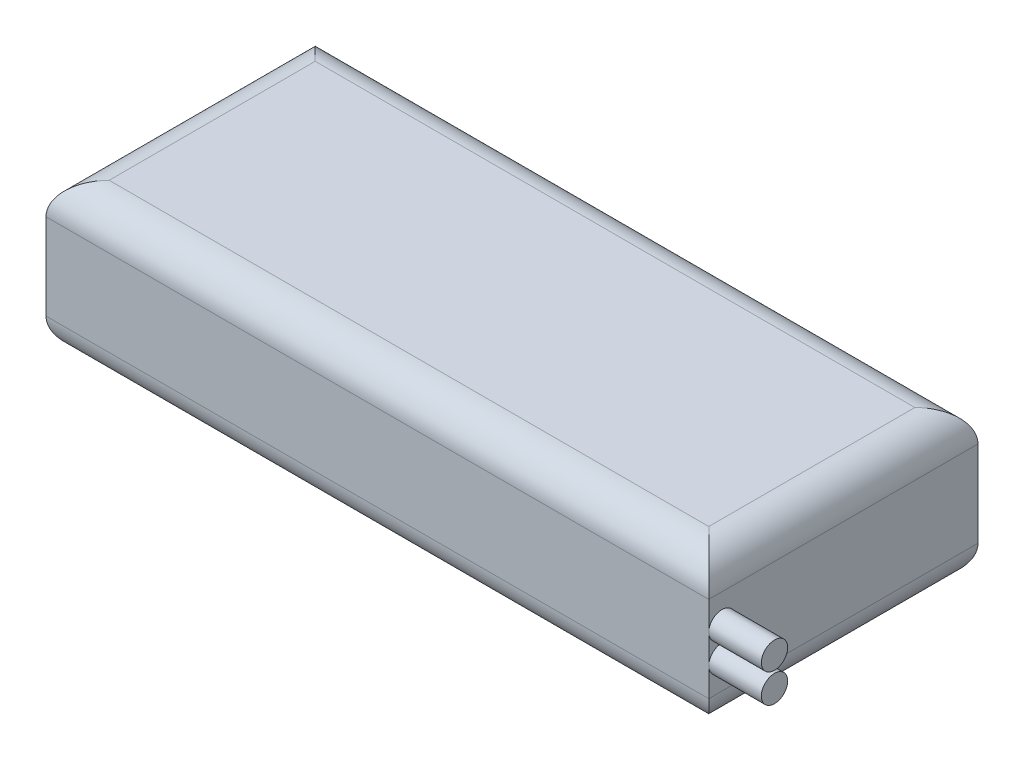
from build123d import *

# Parameters (mm, degrees)
SKETCH1_W           = 160
SKETCH1_H           = 65
BOSS_EXTRUDE1_DEPTH = 36
SKETCH2_R           = 3.175
BOSS_EXTRUDE3_DEPTH = 12.7
FILLET1_R           = 7.62


with BuildPart() as part:
    # Sketch1 → Boss-Extrude1 (new body)
    with BuildSketch(Plane(origin=(0, 0, 0), x_dir=(1, 0, 0), z_dir=(0, 1, 0))):
        with Locations((38.916030534, -15.255725191)):
            Rectangle(SKETCH1_W, SKETCH1_H)
    extrude(amount=BOSS_EXTRUDE1_DEPTH)

    # Sketch2 → Boss-Extrude3 (add)
    with BuildSketch(Plane(origin=(118.916030534, 0, 0), x_dir=(0, 0, -1), z_dir=(1, 0, 0))):
        with Locations(Location((-44.580725191, 21.4925, 0), (0, 0, 180))):
            Circle(SKETCH2_R)
        with Locations(Location((-44.580725191, 14.5075, 0), (0, 0, 180))):
            Circle(SKETCH2_R)
    extrude(amount=BOSS_EXTRUDE3_DEPTH)

    # Fillet1
    fillet1_edges = [part.edges().sort_by_distance(p)[0] for p in [
        (118.916030534, 36, 15.255725191),
        (38.916030534, 36, -17.244274809),
        (-41.083969466, 36, 15.255725191),
        (38.916030534, 0, -17.244274809),
        (118.916030534, 0, 15.255725191),
        (38.916030534, 0, 47.755725191),
        (-41.083969466, 0, 15.255725191),
        (38.916030534, 36, 47.755725191),
    ]]
    fillet(fillet1_edges, radius=FILLET1_R)


solid = part.part
